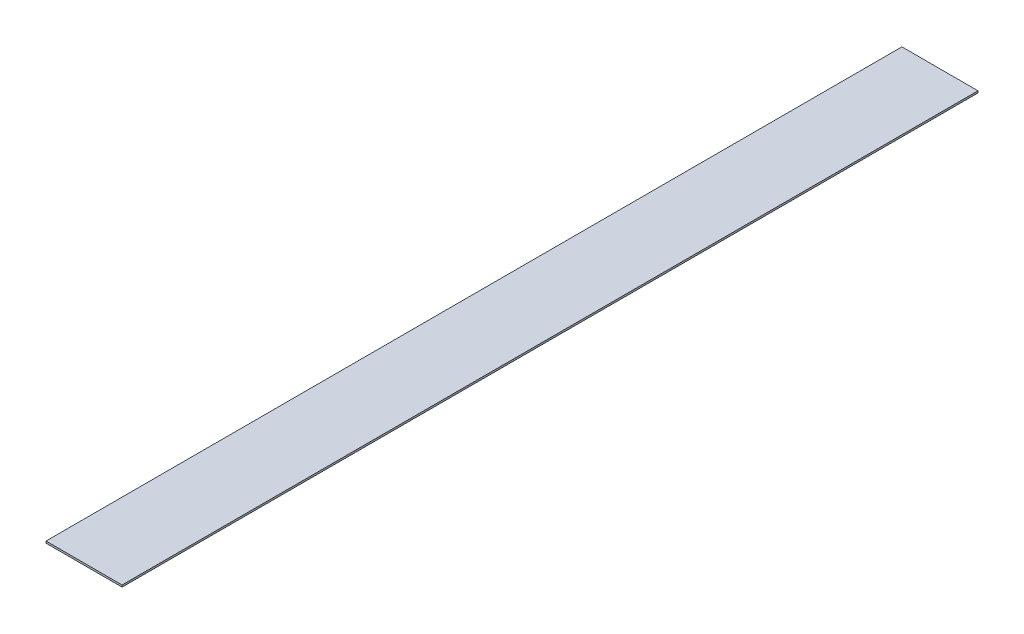
from build123d import *

# Parameters (mm, degrees)
SKETCH1_W           = 8
SKETCH1_H           = 0.2
BOSS_EXTRUDE1_DEPTH = 90


with BuildPart() as part:
    # Sketch1 → Boss-Extrude1 (new body)
    with BuildSketch(Plane.XY):
        Rectangle(SKETCH1_W, SKETCH1_H)
    extrude(amount=BOSS_EXTRUDE1_DEPTH)


solid = part.part
